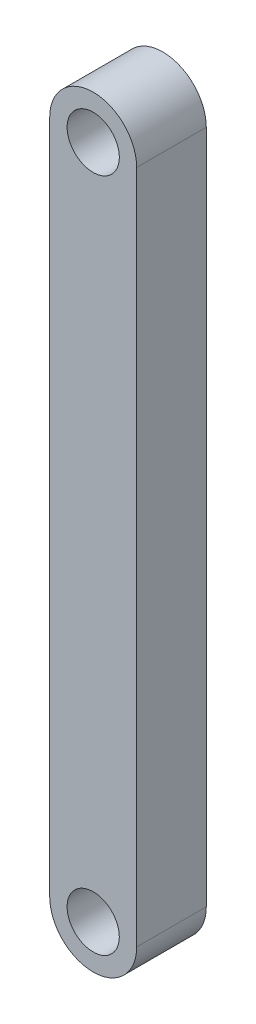
from build123d import *

# Parameters (mm, degrees)
SKETCH1_R           = 1.5
BOSS_EXTRUDE2_DEPTH = 4


with BuildPart() as part:
    # Sketch1 → Boss-Extrude2 (new body)
    with BuildSketch(Plane.XY):
        with BuildLine():
            Line((-2.5, 0), (-2.5, 38.8))
            ThreePointArc((-2.5, 38.8), (0, 41.3), (2.5, 38.8))
            Line((2.5, 38.8), (2.5, 0))
            ThreePointArc((2.5, 0), (0, -2.5), (-2.5, 0))
        make_face()
        Circle(SKETCH1_R, mode=Mode.SUBTRACT)
        with Locations(Location((0, 38.8, 0), (0, 0, 180))):
            Circle(SKETCH1_R, mode=Mode.SUBTRACT)
    extrude(amount=BOSS_EXTRUDE2_DEPTH)


solid = part.part
